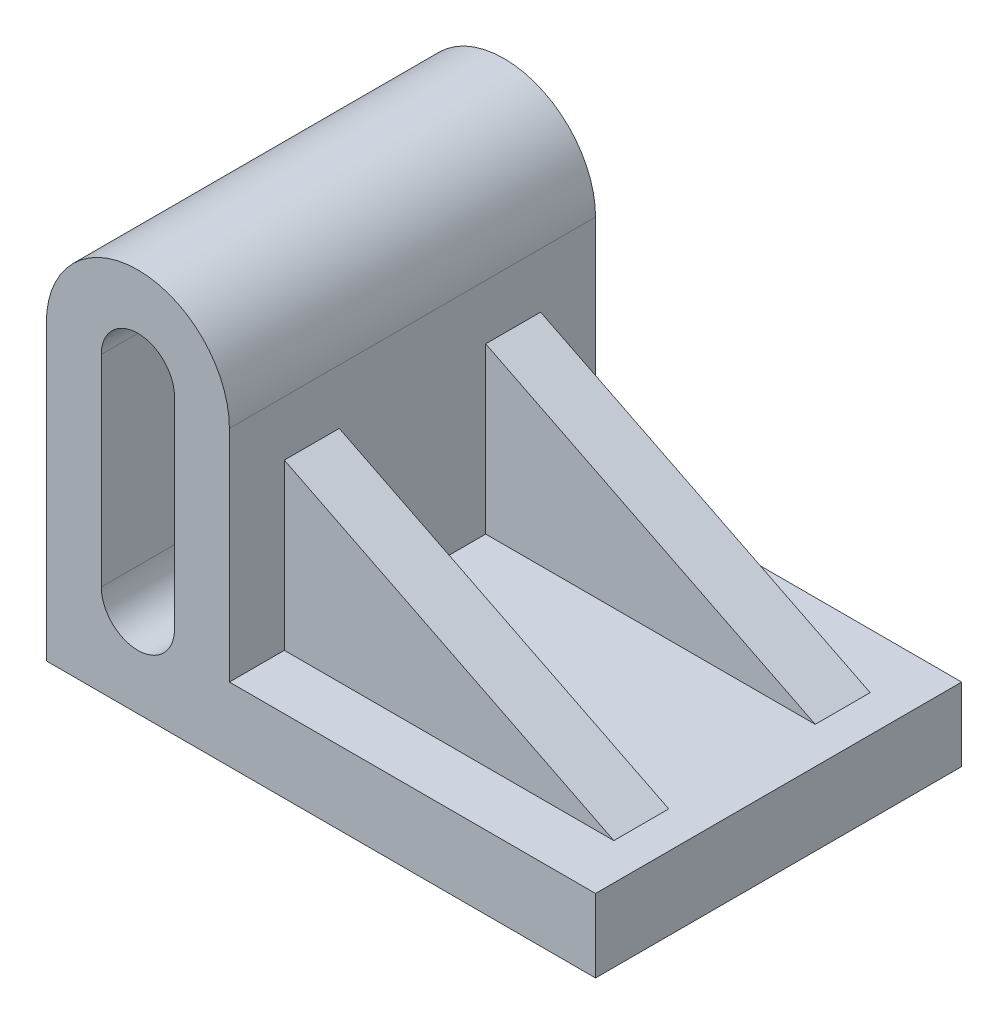
from build123d import *

# Parameters (mm, degrees)
BOSS_EXTRUDE1_DEPTH      = 50
BOSS_EXTRUDE1_DEPTH_BACK = 50
CUT_EXTRUDE2_DEPTH       = 209.62646045
BOSS_EXTRUDE2_DEPTH      = 35
BOSS_EXTRUDE2_DEPTH_BACK = 35
SKETCH5_W                = 127.240652157
SKETCH5_H                = 40
CUT_EXTRUDE3_DEPTH       = 180.51323071


with BuildPart() as part:
    # Sketch1 → Boss-Extrude1 (new, two sides: drawn at the far end of the back side and taken through both)
    with BuildSketch(Plane.XY.offset(-BOSS_EXTRUDE1_DEPTH_BACK)):
        with BuildLine():
            Line((50, 20), (50, 80))
            ThreePointArc((50, 80), (25, 105), (0, 80))
            Line((0, 80), (0, 0))
            Line((0, 0), (150, 0))
            Line((150, 0), (150, 20))
            Line((150, 20), (50, 20))
        make_face()
    extrude(amount=BOSS_EXTRUDE1_DEPTH + BOSS_EXTRUDE1_DEPTH_BACK)

    # Sketch2 → Cut-Extrude2 (cut, through all)
    with BuildSketch(Plane.XY.offset(50)):
        with BuildLine():
            Line((35, 80), (35, 25))
            ThreePointArc((35, 25), (25, 15), (15, 25))
            Line((15, 25), (15, 80))
            ThreePointArc((15, 80), (25, 90), (35, 80))
        make_face()
    extrude(amount=-CUT_EXTRUDE2_DEPTH, mode=Mode.SUBTRACT)

    # Sketch4 → Boss-Extrude2 (add, two sides: drawn at the far end of the back side and taken through both)
    with BuildSketch(Plane.XY.offset(-BOSS_EXTRUDE2_DEPTH_BACK)):
        Polygon((50, 65), (50, 20), (140, 20), align=None)
    extrude(amount=BOSS_EXTRUDE2_DEPTH + BOSS_EXTRUDE2_DEPTH_BACK)

    # Sketch5 → Cut-Extrude3 (cut, through all)
    with BuildSketch(Plane(origin=(0, 20, 0), x_dir=(1, 0, 0), z_dir=(0, 1, 0))):
        with Locations((113.620326078, 0)):
            Rectangle(SKETCH5_W, SKETCH5_H)
    extrude(amount=CUT_EXTRUDE3_DEPTH, mode=Mode.SUBTRACT)


solid = part.part
